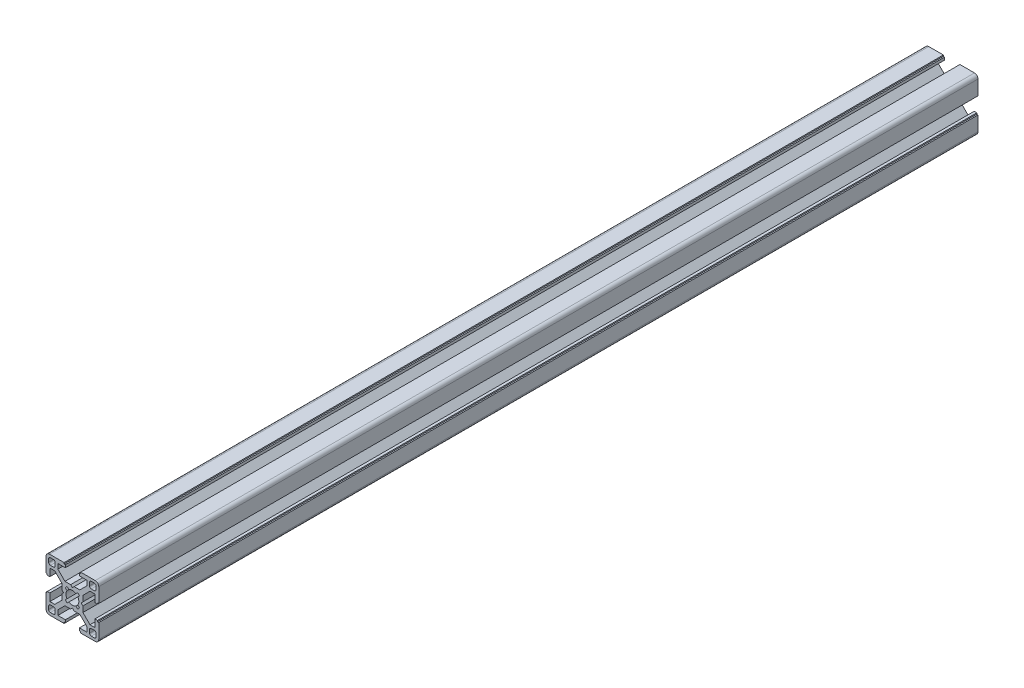
from build123d import *

# Parameters (mm, degrees)
ESTRUSIONE_ESTRUSIONE2_DEPTH = 500


with BuildPart() as part:
    # Schizzo1 → Estrusione-Estrusione2 (new body)
    with BuildSketch(Plane.XY):
        with BuildLine():
            Line((-15, 13), (-15, 4.7))
            Line((-15, 4.7), (-14.3, 4.7))
            Line((-14.3, 4.7), (-14.3, 4))
            Line((-14.3, 4), (-12.8, 4))
            Line((-12.8, 4), (-12.8, 8.25))
            Line((-12.8, 8.25), (-10.017766953, 8.25))
            Line((-10.017766953, 8.25), (-6, 4.232233047))
            Line((-6, 4.232233047), (-6, 1))
            Line((-6, 1), (-5, 0))
            Line((-5, 0), (-6, -1))
            Line((-6, -1), (-6, -4.232233047))
            Line((-6, -4.232233047), (-10.017766953, -8.25))
            Line((-10.017766953, -8.25), (-12.8, -8.25))
            Line((-12.8, -8.25), (-12.8, -4))
            Line((-12.8, -4), (-14.3, -4))
            Line((-14.3, -4), (-14.3, -4.7))
            Line((-14.3, -4.7), (-15, -4.7))
            Line((-15, -4.7), (-15, -13))
            ThreePointArc((-15, -13), (-14.414213562, -14.414213562), (-13, -15))
            Line((-13, -15), (-4.7, -15))
            Line((-4.7, -15), (-4.7, -14.3))
            Line((-4.7, -14.3), (-4, -14.3))
            Line((-4, -14.3), (-4, -12.8))
            Line((-4, -12.8), (-8.25, -12.8))
            Line((-8.25, -12.8), (-8.25, -10.017766953))
            Line((-8.25, -10.017766953), (-4.232233047, -6))
            Line((-4.232233047, -6), (-1, -6))
            Line((-1, -6), (0, -5))
            Line((0, -5), (1, -6))
            Line((1, -6), (4.232233047, -6))
            Line((4.232233047, -6), (8.25, -10.017766953))
            Line((8.25, -10.017766953), (8.25, -12.8))
            Line((8.25, -12.8), (4, -12.8))
            Line((4, -12.8), (4, -14.3))
            Line((4, -14.3), (4.7, -14.3))
            Line((4.7, -14.3), (4.7, -15))
            Line((4.7, -15), (13, -15))
            ThreePointArc((13, -15), (14.414213562, -14.414213562), (15, -13))
            Line((15, -13), (15, -4.7))
            Line((15, -4.7), (14.3, -4.7))
            Line((14.3, -4.7), (14.3, -4))
            Line((14.3, -4), (12.8, -4))
            Line((12.8, -4), (12.8, -8.25))
            Line((12.8, -8.25), (10.017766953, -8.25))
            Line((10.017766953, -8.25), (6, -4.232233047))
            Line((6, -4.232233047), (6, -1))
            Line((6, -1), (5, 0))
            Line((5, 0), (6, 1))
            Line((6, 1), (6, 4.232233047))
            Line((6, 4.232233047), (10.017766953, 8.25))
            Line((10.017766953, 8.25), (12.8, 8.25))
            Line((12.8, 8.25), (12.8, 4))
            Line((12.8, 4), (14.3, 4))
            Line((14.3, 4), (14.3, 4.7))
            Line((14.3, 4.7), (15, 4.7))
            Line((15, 4.7), (15, 13))
            ThreePointArc((15, 13), (14.414213562, 14.414213562), (13, 15))
            Line((13, 15), (4.7, 15))
            Line((4.7, 15), (4.7, 14.3))
            Line((4.7, 14.3), (4, 14.3))
            Line((4, 14.3), (4, 12.8))
            Line((4, 12.8), (8.25, 12.8))
            Line((8.25, 12.8), (8.25, 10.017766953))
            Line((8.25, 10.017766953), (4.232233047, 6))
            Line((4.232233047, 6), (1, 6))
            Line((1, 6), (0, 5))
            Line((0, 5), (-1, 6))
            Line((-1, 6), (-4.232233047, 6))
            Line((-4.232233047, 6), (-8.25, 10.017766953))
            Line((-8.25, 10.017766953), (-8.25, 12.8))
            Line((-8.25, 12.8), (-4, 12.8))
            Line((-4, 12.8), (-4, 14.3))
            Line((-4, 14.3), (-4.7, 14.3))
            Line((-4.7, 14.3), (-4.7, 15))
            Line((-4.7, 15), (-13, 15))
            ThreePointArc((-13, 15), (-14.414213562, 14.414213562), (-15, 13))
        make_face()
        with BuildLine():
            Line((13.5, 10.75), (13.5, 12.5))
            ThreePointArc((13.5, 12.5), (13.207106781, 13.207106781), (12.5, 13.5))
            Line((12.5, 13.5), (10.75, 13.5))
            ThreePointArc((10.75, 13.5), (10.042893219, 13.207106781), (9.75, 12.5))
            Line((9.75, 12.5), (9.75, 10.75))
            ThreePointArc((9.75, 10.75), (10.042893219, 10.042893219), (10.75, 9.75))
            Line((10.75, 9.75), (12.5, 9.75))
            ThreePointArc((12.5, 9.75), (13.207106781, 10.042893219), (13.5, 10.75))
        make_face(mode=Mode.SUBTRACT)
        with BuildLine():
            Line((10.75, -13.5), (12.5, -13.5))
            ThreePointArc((12.5, -13.5), (13.207106781, -13.207106781), (13.5, -12.5))
            Line((13.5, -12.5), (13.5, -10.75))
            ThreePointArc((13.5, -10.75), (13.207106781, -10.042893219), (12.5, -9.75))
            Line((12.5, -9.75), (10.75, -9.75))
            ThreePointArc((10.75, -9.75), (10.042893219, -10.042893219), (9.75, -10.75))
            Line((9.75, -10.75), (9.75, -12.5))
            ThreePointArc((9.75, -12.5), (10.042893219, -13.207106781), (10.75, -13.5))
        make_face(mode=Mode.SUBTRACT)
        with BuildLine():
            Line((-13.5, -10.75), (-13.5, -12.5))
            ThreePointArc((-13.5, -12.5), (-13.207106781, -13.207106781), (-12.5, -13.5))
            Line((-12.5, -13.5), (-10.75, -13.5))
            ThreePointArc((-10.75, -13.5), (-10.042893219, -13.207106781), (-9.75, -12.5))
            Line((-9.75, -12.5), (-9.75, -10.75))
            ThreePointArc((-9.75, -10.75), (-10.042893219, -10.042893219), (-10.75, -9.75))
            Line((-10.75, -9.75), (-12.5, -9.75))
            ThreePointArc((-12.5, -9.75), (-13.207106781, -10.042893219), (-13.5, -10.75))
        make_face(mode=Mode.SUBTRACT)
        with BuildLine():
            Line((1.995536102, 3.056196274), (3.00520382, 4.065863992))
            Line((3.00520382, 4.065863992), (4.065863992, 3.00520382))
            Line((4.065863992, 3.00520382), (3.056196274, 1.995536102))
            ThreePointArc((3.056196274, 1.995536102), (3.498400806, 1.041005187), (3.65, 0))
            ThreePointArc((3.65, 0), (3.498400806, -1.041005187), (3.056196274, -1.995536102))
            Line((3.056196274, -1.995536102), (4.065863992, -3.00520382))
            Line((4.065863992, -3.00520382), (3.00520382, -4.065863992))
            Line((3.00520382, -4.065863992), (1.995536102, -3.056196274))
            ThreePointArc((1.995536102, -3.056196274), (1.041005187, -3.498400806), (0, -3.65))
            ThreePointArc((0, -3.65), (-1.041005187, -3.498400806), (-1.995536102, -3.056196274))
            Line((-1.995536102, -3.056196274), (-3.00520382, -4.065863992))
            Line((-3.00520382, -4.065863992), (-4.065863992, -3.00520382))
            Line((-4.065863992, -3.00520382), (-3.056196274, -1.995536102))
            ThreePointArc((-3.056196274, -1.995536102), (-3.498400806, -1.041005187), (-3.65, 0))
            ThreePointArc((-3.65, 0), (-3.498400806, 1.041005187), (-3.056196274, 1.995536102))
            Line((-3.056196274, 1.995536102), (-4.065863992, 3.00520382))
            Line((-4.065863992, 3.00520382), (-3.00520382, 4.065863992))
            Line((-3.00520382, 4.065863992), (-1.995536102, 3.056196274))
            ThreePointArc((-1.995536102, 3.056196274), (-1.041005187, 3.498400806), (0, 3.65))
            ThreePointArc((0, 3.65), (1.041005187, 3.498400806), (1.995536102, 3.056196274))
        make_face(mode=Mode.SUBTRACT)
        with BuildLine():
            Line((-10.75, 9.75), (-12.5, 9.75))
            ThreePointArc((-12.5, 9.75), (-13.207106781, 10.042893219), (-13.5, 10.75))
            Line((-13.5, 10.75), (-13.5, 12.5))
            ThreePointArc((-13.5, 12.5), (-13.207106781, 13.207106781), (-12.5, 13.5))
            Line((-12.5, 13.5), (-10.75, 13.5))
            ThreePointArc((-10.75, 13.5), (-10.042893219, 13.207106781), (-9.75, 12.5))
            Line((-9.75, 12.5), (-9.75, 10.75))
            ThreePointArc((-9.75, 10.75), (-10.042893219, 10.042893219), (-10.75, 9.75))
        make_face(mode=Mode.SUBTRACT)
    extrude(amount=ESTRUSIONE_ESTRUSIONE2_DEPTH)


solid = part.part
